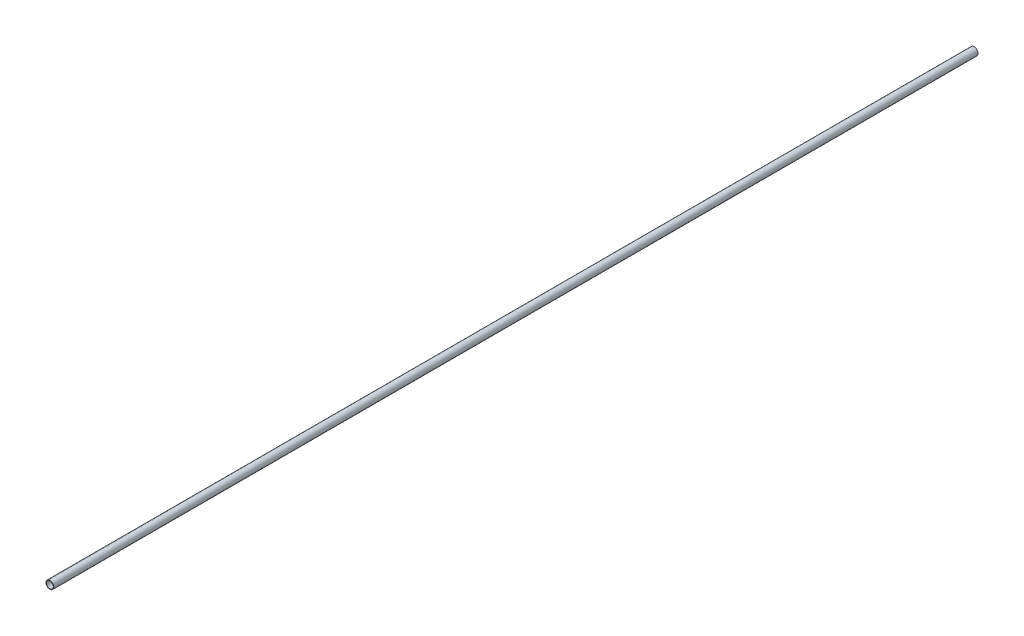
from build123d import *

# Parameters (mm, degrees)
EXTRUDE_1_DEPTH      = 474.25
EXTRUDE_1_DEPTH_BACK = 474.25
SKETCH_1_R           = 4
SKETCH_1_R_2         = 3.5


with BuildPart() as part:
    # 草图1 → 凸台-拉伸1 (new, two sides: drawn at the far end of the back side and taken through both)
    with BuildSketch(Plane.XY.offset(-EXTRUDE_1_DEPTH_BACK)):
        Circle(SKETCH_1_R)
        Circle(SKETCH_1_R_2, mode=Mode.SUBTRACT)
    extrude(amount=EXTRUDE_1_DEPTH + EXTRUDE_1_DEPTH_BACK)


solid = part.part
